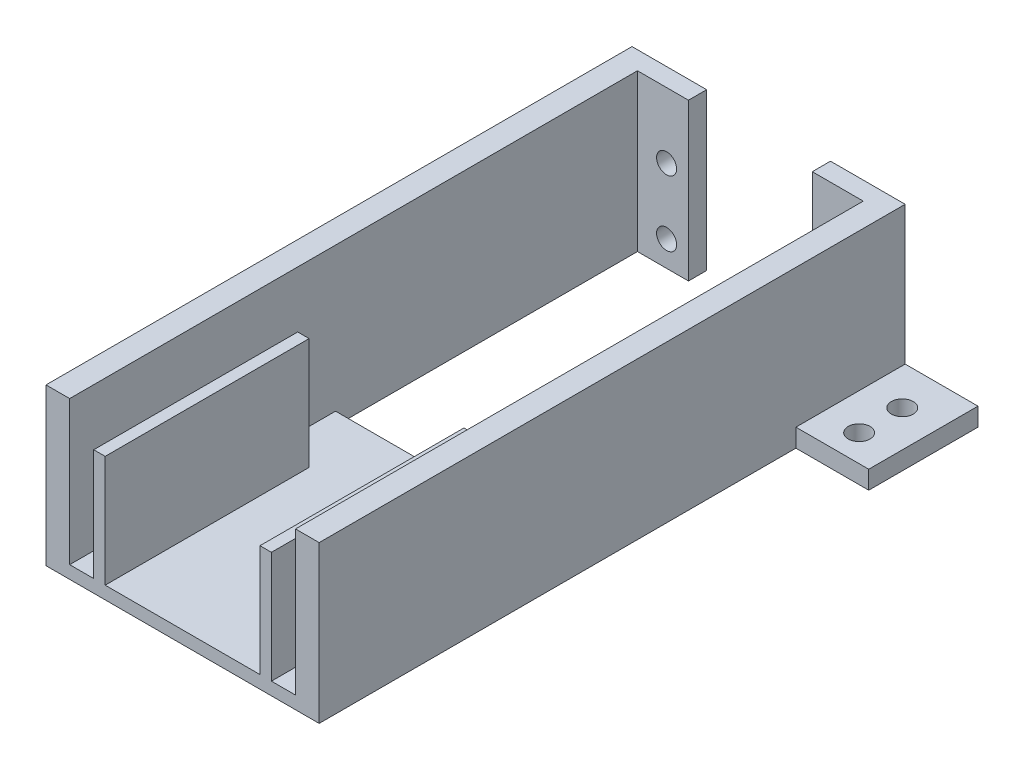
from build123d import *

# Parameters (mm, degrees)
SKETCH1_R             = 2.75
BOSS_EXTRUDE1_DEPTH   = 5
BOSS_EXTRUDE1_2_DEPTH = 5
SKETCH16_W            = 6.5
SKETCH16_H            = 43
BOSS_EXTRUDE2_DEPTH   = 162.9
SKETCH18_W            = 80
SKETCH18_H            = 3.5
BOSS_EXTRUDE3_DEPTH   = 64.9
SKETCH19_W            = 5
SKETCH19_H            = 39.5
BOSS_EXTRUDE4_DEPTH   = 64.9
SKETCH20_W            = 30
SKETCH20_H            = 5
BOSS_EXTRUDE5_DEPTH   = 20
SKETCH21_W            = 30
SKETCH21_H            = 5
BOSS_EXTRUDE6_DEPTH   = 20
SKETCH22_R            = 3
CUT_EXTRUDE1_DEPTH    = 20
SKETCH24_W            = 3.140120034
SKETCH24_H            = 30.638672015
SKETCH24_W_2          = 3.14
BOSS_EXTRUDE8_DEPTH   = 58
SKETCH25_W            = 75
SKETCH25_H            = 43
CUT_EXTRUDE2_DEPTH    = 7


with BuildPart() as part:
    # Sketch1 → Boss-Extrude1 (new body)
    with BuildSketch(Plane.XY):
        Polygon((20.5, 43), (20.5, 18), (20.5, 0), (0, 0), (0, 43), align=None)
        with Locations((14.5, 25)):
            Circle(SKETCH1_R, mode=Mode.SUBTRACT)
        with Locations((14.5, 7)):
            Circle(SKETCH1_R, mode=Mode.SUBTRACT)
    extrude(amount=BOSS_EXTRUDE1_DEPTH)



with BuildPart() as body_2:
    # Sketch1 → Boss-Extrude1 2 (new body)
    with BuildSketch(Plane.XY):
        Polygon((75, 0), (75, 43), (54.5, 43), (54.5, 18), (54.5, 0), align=None)
        with Locations((60.5, 7)):
            Circle(SKETCH1_R, mode=Mode.SUBTRACT)
        with Locations((60.5, 25)):
            Circle(SKETCH1_R, mode=Mode.SUBTRACT)
    extrude(amount=BOSS_EXTRUDE1_2_DEPTH)


with BuildPart() as part_1:
    add(part.part)

    add(body_2.part)  # Boss-Extrude2 merges body 2
    # Sketch16 → Boss-Extrude2 (add)
    with BuildSketch(Plane.XY.offset(5)):
        with Locations((71.75, 21.5)):
            Rectangle(SKETCH16_W, SKETCH16_H)
        with Locations((3.25, 21.5)):
            Rectangle(SKETCH16_W, SKETCH16_H)
    extrude(amount=BOSS_EXTRUDE2_DEPTH)

    # Sketch18 → Boss-Extrude3 (add)
    with BuildSketch(Plane.ZY.offset(-68.5)):
        with Locations((127.9, 1.75)):
            Rectangle(SKETCH18_W, SKETCH18_H)
    extrude(amount=BOSS_EXTRUDE3_DEPTH)

    # Sketch19 → Boss-Extrude4 (add)
    with BuildSketch(Plane.ZY.offset(-68.5)):
        with Locations((165.4, 23.25)):
            Rectangle(SKETCH19_W, SKETCH19_H)
    extrude(amount=BOSS_EXTRUDE4_DEPTH)

    # Sketch20 → Boss-Extrude5 (add)
    with BuildSketch(Plane.ZY):
        with Locations((15, 2.5)):
            Rectangle(SKETCH20_W, SKETCH20_H)
    extrude(amount=BOSS_EXTRUDE5_DEPTH)

    # Sketch21 → Boss-Extrude6 (add)
    with BuildSketch(Plane(origin=(75, 0, 0), x_dir=(0, 0, -1), z_dir=(1, 0, 0))):
        with Locations((-15, 2.5)):
            Rectangle(SKETCH21_W, SKETCH21_H)
    extrude(amount=BOSS_EXTRUDE6_DEPTH)

    # Sketch22 → Cut-Extrude1 (cut)
    with BuildSketch(Plane(origin=(0, 5, 0), x_dir=(1, 0, 0), z_dir=(0, 1, 0))):
        with Locations(Location((-10, -10.799084074, 0), (0, 0, 270))):
            Circle(SKETCH22_R)
        with Locations(Location((-10, -22.633830435, 0), (0, 0, 270))):
            Circle(SKETCH22_R)
        with Locations(Location((85, -10.799084074, 0), (0, 0, 270))):
            Circle(SKETCH22_R)
        with Locations(Location((85, -22.633830435, 0), (0, 0, 270))):
            Circle(SKETCH22_R)
    extrude(amount=-CUT_EXTRUDE1_DEPTH, mode=Mode.SUBTRACT)

    # Sketch24 → Boss-Extrude8 (add)
    with BuildSketch(Plane(origin=(0, 0, 162.9), x_dir=(-1, 0, 0), z_dir=(0, 0, -1))):
        with Locations((-60.320060017, 18.819336008)):
            Rectangle(SKETCH24_W, SKETCH24_H)
        with Locations((-14.68, 18.819336008)):
            Rectangle(SKETCH24_W_2, SKETCH24_H)
    extrude(amount=BOSS_EXTRUDE8_DEPTH)

    # Sketch25 → Cut-Extrude2 (cut)
    with BuildSketch(Plane.XY.offset(167.9)):
        with Locations((37.5, 21.5)):
            Rectangle(SKETCH25_W, SKETCH25_H)
    extrude(amount=-CUT_EXTRUDE2_DEPTH, mode=Mode.SUBTRACT)


solid = part_1.part
